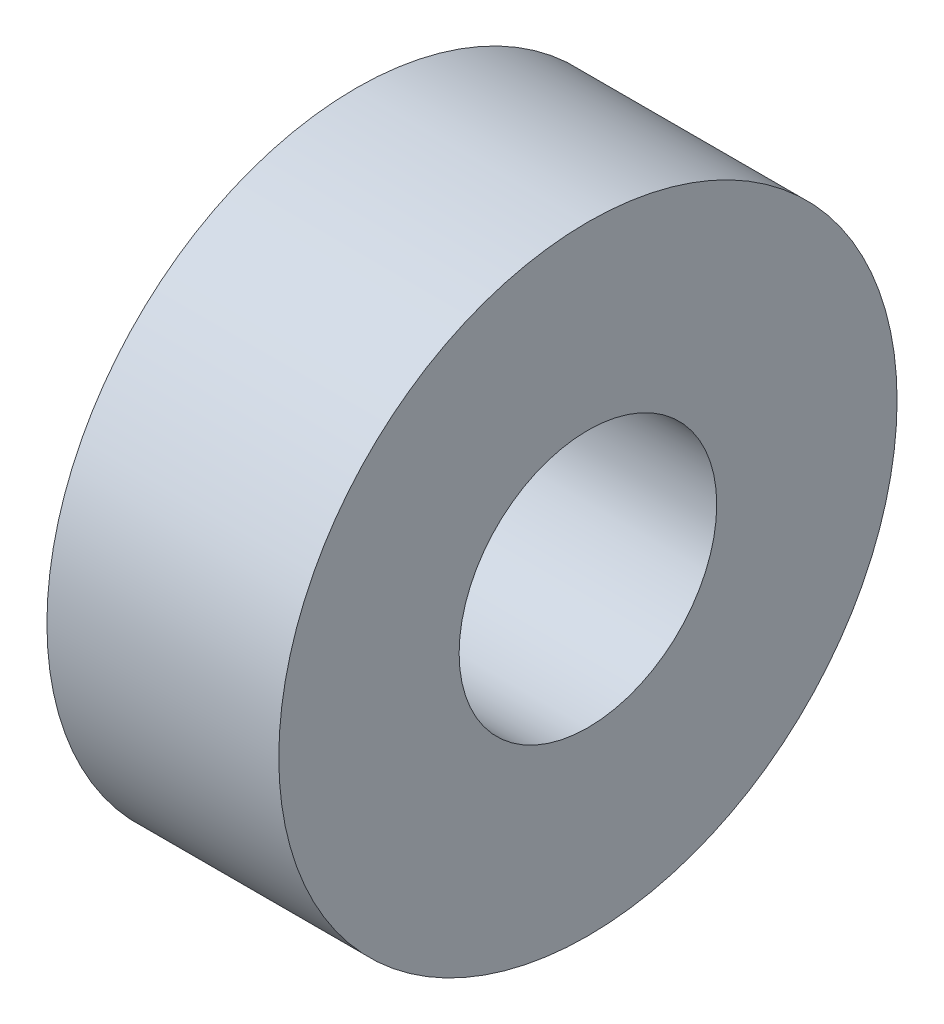
from build123d import *

# Parameters (mm, degrees)
SKETCH1_W = 9
SKETCH1_H = 7


with BuildPart() as part:
    # Sketch1 → Revolve1 (revolve)
    with BuildSketch(Plane.XY, mode=Mode.PRIVATE) as revolve1_sk:
        with Locations((4.5, 8.5)):
            Rectangle(SKETCH1_W, SKETCH1_H)
    revolve(revolve1_sk.sketch.rotate(Axis((0, 0, 0), (1, 0, 0)), 90), axis=Axis((0, 0, 0), (1, 0, 0)))


solid = part.part
